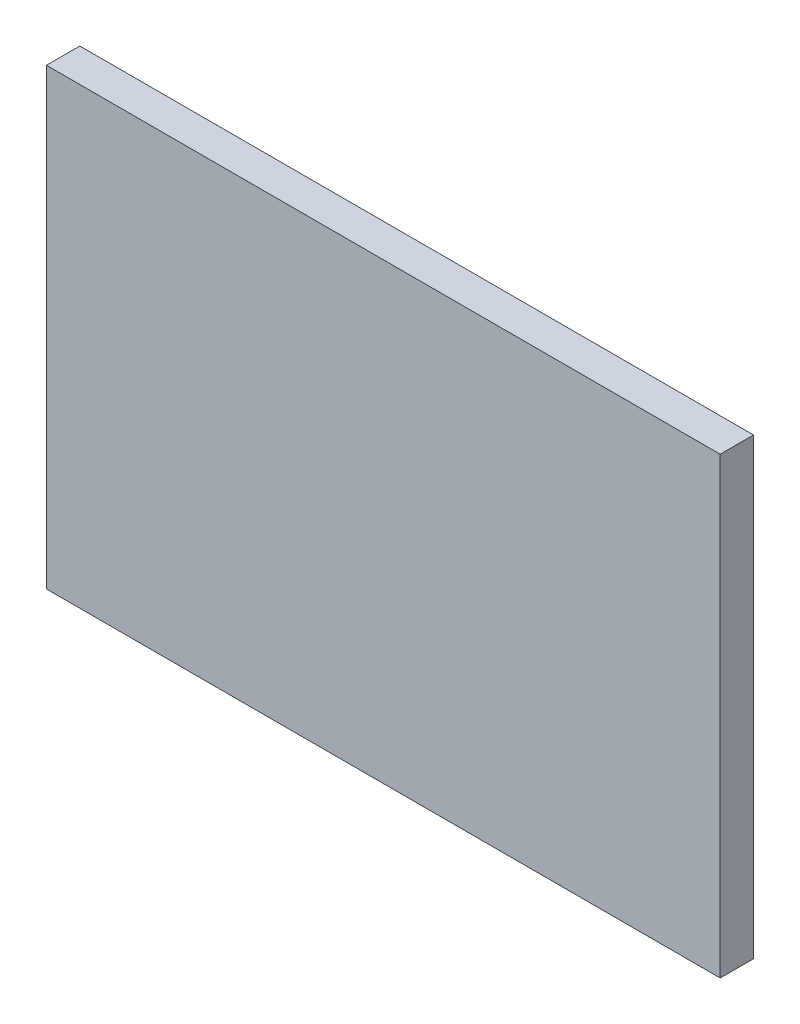
from build123d import *

# Parameters (mm, degrees)
SKETCH_1_W      = 101
SKETCH_1_H      = 68
EXTRUDE_1_DEPTH = 5


with BuildPart() as part:
    # 草图1 → 凸台-拉伸1 (new body)
    with BuildSketch(Plane.XY):
        Rectangle(SKETCH_1_W, SKETCH_1_H)
    extrude(amount=EXTRUDE_1_DEPTH)


solid = part.part
